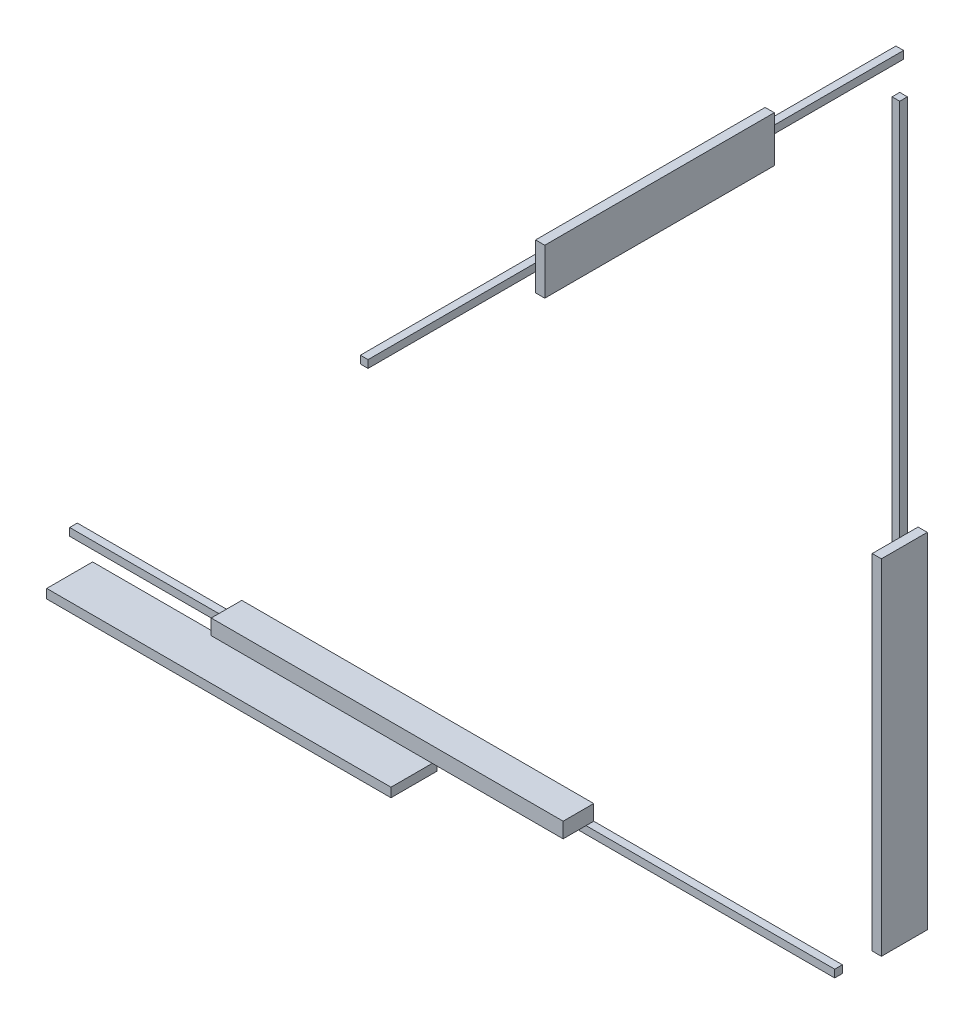
from build123d import *

# Parameters (mm, degrees)
OVERALL_START                                = -0.5
SKETCH_1_W                                   = 100
SKETCH_1_H                                   = 1
OVERALL_X_DIMENSION_MARKER_BODY_LENGTH_DEPTH = 1
SKETCH_2_W                                   = 1
SKETCH_2_H                                   = 90
OVERALL_Y_DIMENSION_MARKER_BODY_WIDTH_DEPTH  = 1
SKETCH_3_W                                   = 1
SKETCH_3_H                                   = 1
OVERALL_Z_DIMENSION_MARKER_BODY_HEIGHT_DEPTH = 70
FRONT_START                                  = 5
SKETCH_4_W                                   = 46
SKETCH_4_H                                   = 2
FRONT_ARROW_SENSOR_FACE_MARKER_DEPTH         = 4
SKETCH_5_W                                   = 45
SKETCH_5_H                                   = 1.2
OVERALL_LABEL_PLATE_100MM_DEPTH              = 6
SKETCH_6_W                                   = 1.2
SKETCH_6_H                                   = 45
OVERALL_LABEL_PLATE_90MM_DEPTH               = 6
OVERALL_START_2                              = 20
SKETCH_7_W                                   = 1.2
SKETCH_7_H                                   = 6
OVERALL_LABEL_PLATE_70MM_DEPTH               = 30


with BuildPart() as part:
    # 草图1 → overall X dimension marker - body length 100 mm (new body)
    with BuildSketch(Plane.XY.offset(OVERALL_START)):
        with Locations((0, -58)):
            Rectangle(SKETCH_1_W, SKETCH_1_H)
    extrude(amount=OVERALL_X_DIMENSION_MARKER_BODY_LENGTH_DEPTH)


with BuildPart() as body_2:
    # 草图2 → overall Y dimension marker - body width 90 mm (new body)
    with BuildSketch(Plane.XY.offset(OVERALL_START)):
        with Locations((58, 0)):
            Rectangle(SKETCH_2_W, SKETCH_2_H)
    extrude(amount=OVERALL_Y_DIMENSION_MARKER_BODY_WIDTH_DEPTH)


with BuildPart() as body_3:
    # 草图3 → overall Z dimension marker - body height 70 mm (new body)
    with BuildSketch(Plane.XY):
        with Locations((58, 50)):
            Rectangle(SKETCH_3_W, SKETCH_3_H)
    extrude(amount=OVERALL_Z_DIMENSION_MARKER_BODY_HEIGHT_DEPTH)


with BuildPart() as body_4:
    # 草图4 → front arrow / sensor face marker (new body)
    with BuildSketch(Plane.XY.offset(FRONT_START)):
        with Locations((0, -51)):
            Rectangle(SKETCH_4_W, SKETCH_4_H)
    extrude(amount=FRONT_ARROW_SENSOR_FACE_MARKER_DEPTH)


with BuildPart() as body_5:
    # 草图5 → overall label plate - 100mm (new body)
    with BuildSketch(Plane.XY):
        with Locations((-25, -61)):
            Rectangle(SKETCH_5_W, SKETCH_5_H)
    extrude(amount=OVERALL_LABEL_PLATE_100MM_DEPTH)


with BuildPart() as body_6:
    # 草图6 → overall label plate - 90mm (new body)
    with BuildSketch(Plane.XY):
        with Locations((61, -25)):
            Rectangle(SKETCH_6_W, SKETCH_6_H)
    extrude(amount=OVERALL_LABEL_PLATE_90MM_DEPTH)


with BuildPart() as body_7:
    # 草图7 → overall label plate - 70mm (new body)
    with BuildSketch(Plane.XY.offset(OVERALL_START_2)):
        with Locations((61, 52)):
            Rectangle(SKETCH_7_W, SKETCH_7_H)
    extrude(amount=OVERALL_LABEL_PLATE_70MM_DEPTH)


solid = Compound([part.part, body_2.part, body_3.part, body_4.part, body_5.part, body_6.part, body_7.part])
